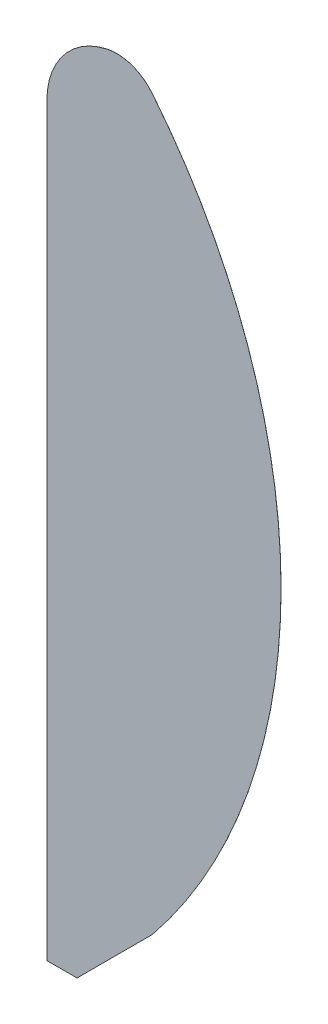
from build123d import *

# Parameters (mm, degrees)
BOSS_EXTRUDE1_DEPTH = 0.01


with BuildPart() as part:
    # Sketch1 → Boss-Extrude1 (new body)
    with BuildSketch(Plane(origin=(0, 0, 0), x_dir=(0, 1, 0), z_dir=(0, 0, 1))):
        with BuildLine():
            Line((0, 0), (123.624, 0))
            ThreePointArc((123.624, 0), (131.579585711, -2.812435924), (136, -10))
            ThreePointArc((136, -10), (135.735043894, -14.125137593), (133.348149335, -17.5))
            ThreePointArc((133.348149335, -17.5), (72.924074667, -38.857142857), (12.5, -17.5))
            Line((12.5, -17.5), (0, -5))
            Line((0, -5), (0, 0))
        make_face()
    extrude(amount=BOSS_EXTRUDE1_DEPTH)


solid = part.part
